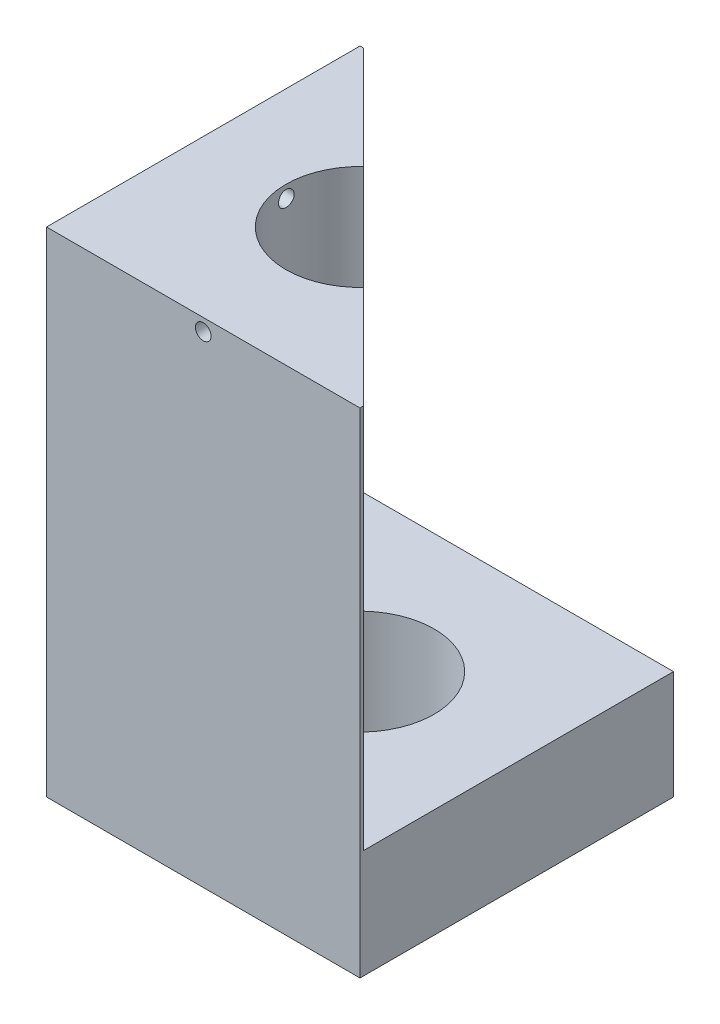
from build123d import *

# Parameters (mm, degrees)
SKETCH1_W                             = 12.7
SKETCH1_H                             = 12.7
BOSS_EXTRUDE1_DEPTH                   = 20
SKETCH2_R                             = 3
CUT_EXTRUDE1_DEPTH                    = 27.880848201
CUT_EXTRUDE2_DEPTH                    = 15.6
F_72_0_025_DIAMETER_HOLE1_D           = 0.635
F_72_0_025_DIAMETER_HOLE1_ON_FACE_2_D = 0.635


with BuildPart() as part:
    # Sketch1 → Boss-Extrude1 (new body)
    with BuildSketch(Plane(origin=(0, 0, 0), x_dir=(1, 0, 0), z_dir=(0, 1, 0))):
        with Locations((6.35, 6.35)):
            Rectangle(SKETCH1_W, SKETCH1_H)
    extrude(amount=BOSS_EXTRUDE1_DEPTH)

    # Sketch2 → Cut-Extrude1 (cut, through all)
    with BuildSketch(Plane(origin=(0, 20, 0), x_dir=(1, 0, 0), z_dir=(0, 1, 0))):
        with Locations(Location((6.35, 6.35, 0), (0, 0, 270))):
            Circle(SKETCH2_R)
    extrude(amount=-CUT_EXTRUDE1_DEPTH, mode=Mode.SUBTRACT)

    # Sketch3 → Cut-Extrude2 (cut)
    with BuildSketch(Plane(origin=(0, 20, 0), x_dir=(1, 0, 0), z_dir=(0, 1, 0))):
        Polygon((12.7, 0.143684098), (0.143684098, 12.7), (12.7, 12.7), align=None)
    extrude(amount=-CUT_EXTRUDE2_DEPTH, mode=Mode.SUBTRACT)

    # #72 (0.025) Diameter Hole1 (through all)
    with Locations(Plane(origin=(6.35, 19.5, 0), x_dir=(1, 0, 0), z_dir=(0, 0, 1))):
        with Locations((0, 0)):
            Hole(F_72_0_025_DIAMETER_HOLE1_D / 2)

    # #72 (0.025) Diameter Hole1 on face 2 (through all)
    with Locations(Plane(origin=(0, 19.5, -6.35), x_dir=(0, 0, -1), z_dir=(-1, 0, 0))):
        with Locations((0, 0)):
            Hole(F_72_0_025_DIAMETER_HOLE1_ON_FACE_2_D / 2)


solid = part.part
